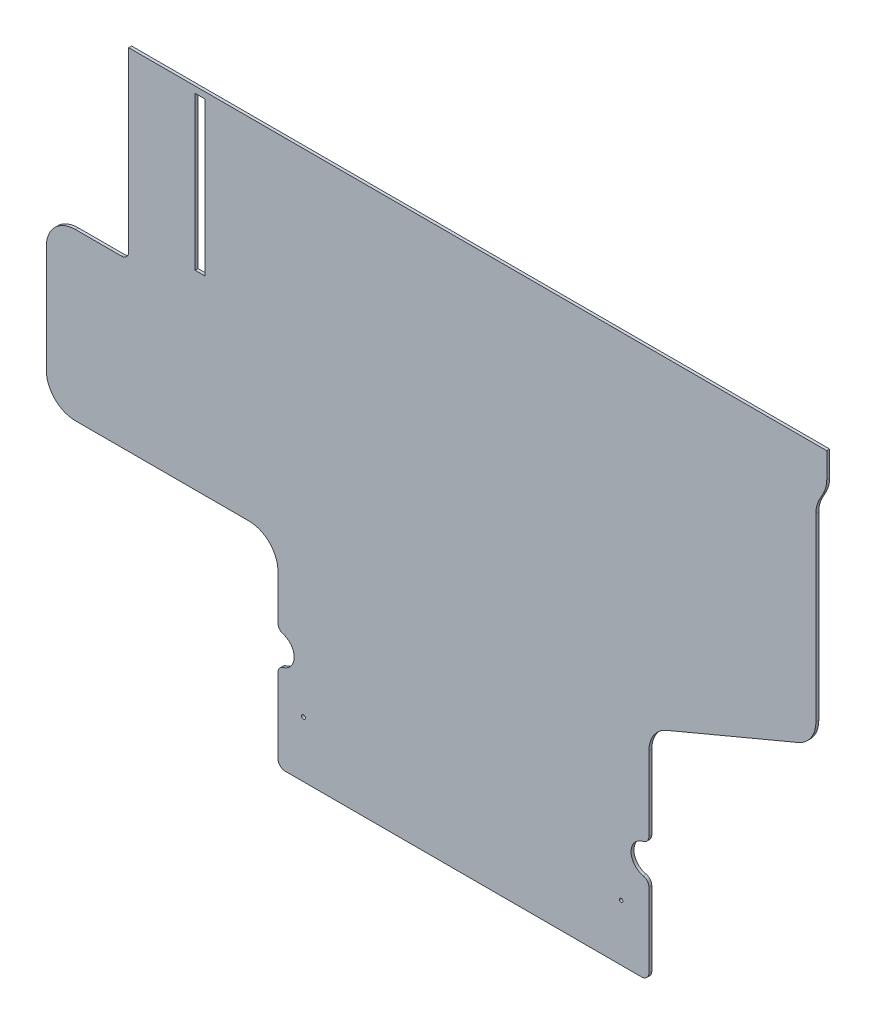
from build123d import *

# Parameters (mm, degrees)
ESQUISSE1_R        = 0.068980455
ESQUISSE1_R_2      = 0.06150295
ESQUISSE1_W        = 0.337022694
ESQUISSE1_H        = 5.280022209
BOSS_EXTRU_1_DEPTH = 0.1


with BuildPart() as part:
    # Esquisse1 → Boss.-Extru.1 (new body)
    with BuildSketch(Plane.XY):
        with BuildLine():
            Line((69.009405392, 230.580792913), (69.009405392, 229.722196339))
            ThreePointArc((69.009405392, 229.722196339), (68.979401433, 229.479075631), (68.891190034, 229.250544089))
            Line((68.891190034, 229.250544089), (68.752437477, 228.991137135))
            ThreePointArc((68.752437477, 228.991137135), (68.664226077, 228.762605593), (68.634222119, 228.519484885))
            Line((68.634222119, 228.519484885), (68.634222119, 222.299593089))
            ThreePointArc((68.634222119, 222.299593089), (68.467011491, 221.746003113), (68.021298395, 221.377545392))
            Line((68.021298395, 221.377545392), (63.492336438, 219.476283954))
            ThreePointArc((63.492336438, 219.476283954), (63.046623342, 219.107826233), (62.879412715, 218.554236256))
            Line((62.879412715, 218.554236256), (62.879412715, 215.999425613))
            ThreePointArc((62.879412715, 215.999425613), (62.823397918, 215.841724183), (62.680454788, 215.754691662))
            ThreePointArc((62.680454788, 215.754691662), (62.265082422, 215.243750871), (62.680454788, 214.732810081))
            ThreePointArc((62.680454788, 214.732810081), (62.823397918, 214.645777559), (62.879412715, 214.48807613))
            Line((62.879412715, 214.48807613), (62.879412715, 211.933337892))
            ThreePointArc((62.879412715, 211.933337892), (62.80618941, 211.756561196), (62.629412715, 211.683337892))
            Line((62.629412715, 211.683337892), (50.34681626, 211.683337892))
            ThreePointArc((50.34681626, 211.683337892), (50.170039564, 211.756561196), (50.09681626, 211.933337892))
            Line((50.09681626, 211.933337892), (50.09681626, 214.506095719))
            ThreePointArc((50.09681626, 214.506095719), (50.14774452, 214.657325486), (50.2797798, 214.746940302))
            ThreePointArc((50.2797798, 214.746940302), (50.65644704, 215.242767306), (50.2797798, 215.73859431))
            ThreePointArc((50.2797798, 215.73859431), (50.14774452, 215.828209125), (50.09681626, 215.979438893))
            Line((50.09681626, 215.979438893), (50.09681626, 217.526780439))
            ThreePointArc((50.09681626, 217.526780439), (49.803923041, 218.233887221), (49.09681626, 218.526780439))
            Line((49.09681626, 218.526780439), (43.115034211, 218.526780439))
            ThreePointArc((43.115034211, 218.526780439), (42.40792743, 218.819673658), (42.115034211, 219.526780439))
            Line((42.115034211, 219.526780439), (42.115034211, 223.236736654))
            ThreePointArc((42.115034211, 223.236736654), (42.40792743, 223.943843435), (43.115034211, 224.236736654))
            Line((43.115034211, 224.236736654), (44.704420557, 224.236736654))
            ThreePointArc((44.704420557, 224.236736654), (44.881197252, 224.309959959), (44.954420557, 224.486736654))
            Line((44.954420557, 224.486736654), (44.954420557, 230.580792913))
            Line((44.954420557, 230.580792913), (69.009405392, 230.580792913))
        make_face()
        with Locations((50.977150622, 213.618363216)):
            Circle(ESQUISSE1_R, mode=Mode.SUBTRACT)
        with Locations((61.924613366, 213.618363216)):
            Circle(ESQUISSE1_R_2, mode=Mode.SUBTRACT)
        with Locations((47.409826256, 227.722685683)):
            Rectangle(ESQUISSE1_W, ESQUISSE1_H, mode=Mode.SUBTRACT)
    extrude(amount=BOSS_EXTRU_1_DEPTH)


solid = part.part
